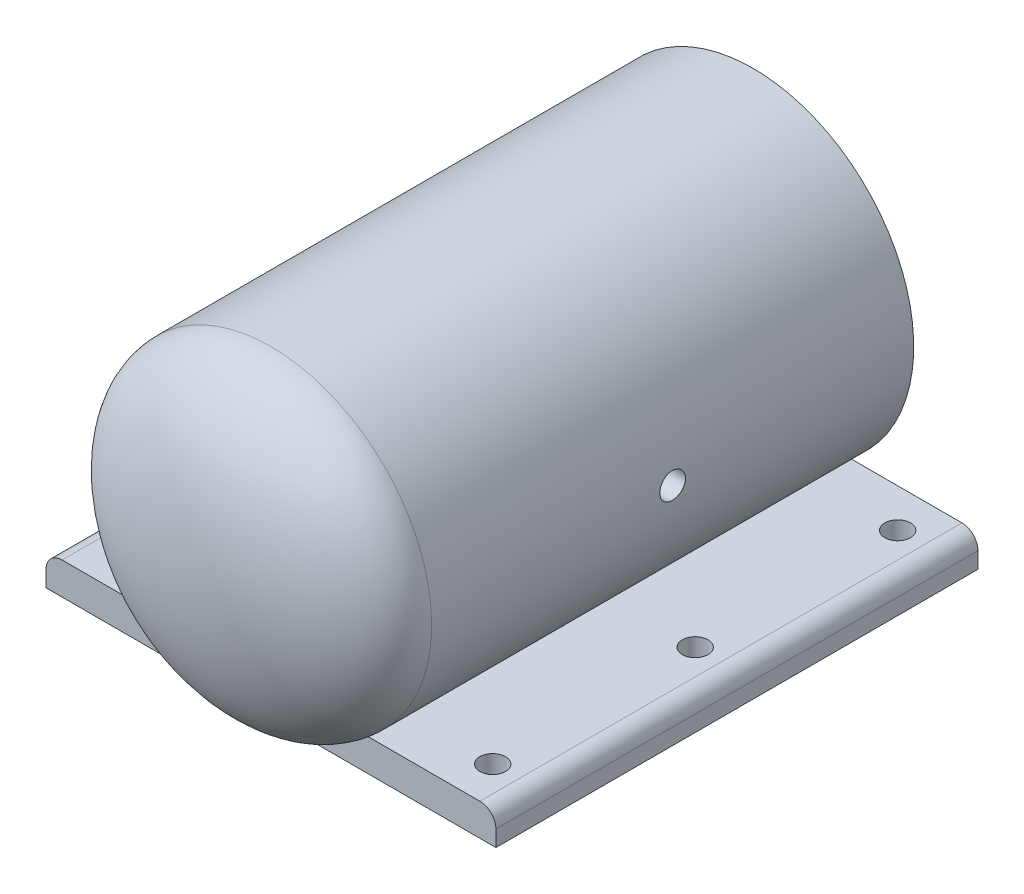
from build123d import *

# Parameters (mm, degrees)
SKETCH1_R               = 20
BOSS_EXTRUDE1_DEPTH     = 75
CUT_EXTRUDE2_DEPTH      = 87.458082329
CUT_EXTRUDE2_DEPTH_BACK = 87.458082329
SKETCH3_R               = 2
SKETCH2_R               = 2
CUT_EXTRUDE3_DEPTH      = 10
SKETCH2_4_R             = 2
CUT_EXTRUDE4_DEPTH      = 10


with BuildPart() as part:
    # Sketch1 → Boss-Extrude1 (new body)
    with BuildSketch(Plane.XY):
        with BuildLine():
            Line((-32.5, -20), (-15, -20))
            ThreePointArc((-15, -20), (0, 25), (15, -20))
            Line((15, -20), (32.5, -20))
            ThreePointArc((32.5, -20), (34.267766953, -20.732233047), (35, -22.5))
            Line((35, -22.5), (35, -25))
            Line((35, -25), (-35, -25))
            Line((-35, -25), (-35, -22.5))
            ThreePointArc((-35, -22.5), (-34.267766953, -20.732233047), (-32.5, -20))
        make_face()
        Circle(SKETCH1_R, mode=Mode.SUBTRACT)
    extrude(amount=BOSS_EXTRUDE1_DEPTH)

    # Sketch3 → Cut-Extrude2 (cut, two sides: drawn at the far end of the back side and taken through both)
    with BuildSketch(Plane(origin=(0, 0, 0), x_dir=(0, 0, -1), z_dir=(1, 0, 0)).offset(-CUT_EXTRUDE2_DEPTH_BACK)):
        with Locations((-37.5, 0)):
            Circle(SKETCH3_R)
    extrude(amount=CUT_EXTRUDE2_DEPTH + CUT_EXTRUDE2_DEPTH_BACK, mode=Mode.SUBTRACT)

    # Sketch4 → Revolve1 (revolve)
    with BuildSketch(Plane(origin=(0, 0, 0), x_dir=(0, 0, -1), z_dir=(1, 0, 0))):
        with BuildLine():
            Line((-87.5, 0), (-84.5, 0))
            add(Edge.make_bspline(
                [(-75, 22), (-75.216185099, 22), (-75.636923923, 21.95894914), (-76.546271577, 21.69469962), (-77.844229013, 20.93469698), (-79.554525777, 19.135071068), (-81.193703824, 16.461120363), (-82.603978079, 13.036619939), (-83.678181323, 9.024220506), (-84.34830956, 4.618558705), (-84.5, 1.528633227), (-84.5, 0)],
                knots=[0, 0, 0, 0, 0.09817477, 0.196349541, 0.392699082, 0.589048623, 0.785398163, 0.981747704, 1.178097245, 1.374446786, 1.570796327, 1.570796327, 1.570796327, 1.570796327], degree=3))
            Line((-75, 22), (-75, 25))
            add(Edge.make_bspline(
                [(-75, 25), (-87.5, 25), (-87.5, 0)],
                knots=[0, 0, 0, 1.570796327, 1.570796327, 1.570796327], degree=2, weights=[1, 0.707106781, 1]))
        make_face()
    revolve(axis=Axis((0, 0, 87.5), (0, 0, -1)))

    # Sketch2 → Cut-Extrude3 (cut)
    with BuildSketch(Plane(origin=(0, -20, 0), x_dir=(1, 0, 0), z_dir=(0, 1, 0))):
        with Locations((28.5, -69)):
            Circle(SKETCH2_R)
    extrude(amount=-CUT_EXTRUDE3_DEPTH, mode=Mode.SUBTRACT)

    # Sketch2<4> → Cut-Extrude4 (cut)
    with BuildSketch(Plane(origin=(0, -20, 0), x_dir=(1, 0, 0), z_dir=(0, 1, 0))):
        with Locations((-28.5, -6)):
            Circle(SKETCH2_4_R)
        with Locations((28.5, -6)):
            Circle(SKETCH2_4_R)
        with Locations((-28.5, -69)):
            Circle(SKETCH2_4_R)
        with Locations((28.5, -37.5)):
            Circle(SKETCH2_4_R)
        with Locations((-28.5, -37.5)):
            Circle(SKETCH2_4_R)
    extrude(amount=-CUT_EXTRUDE4_DEPTH, mode=Mode.SUBTRACT)


solid = part.part
